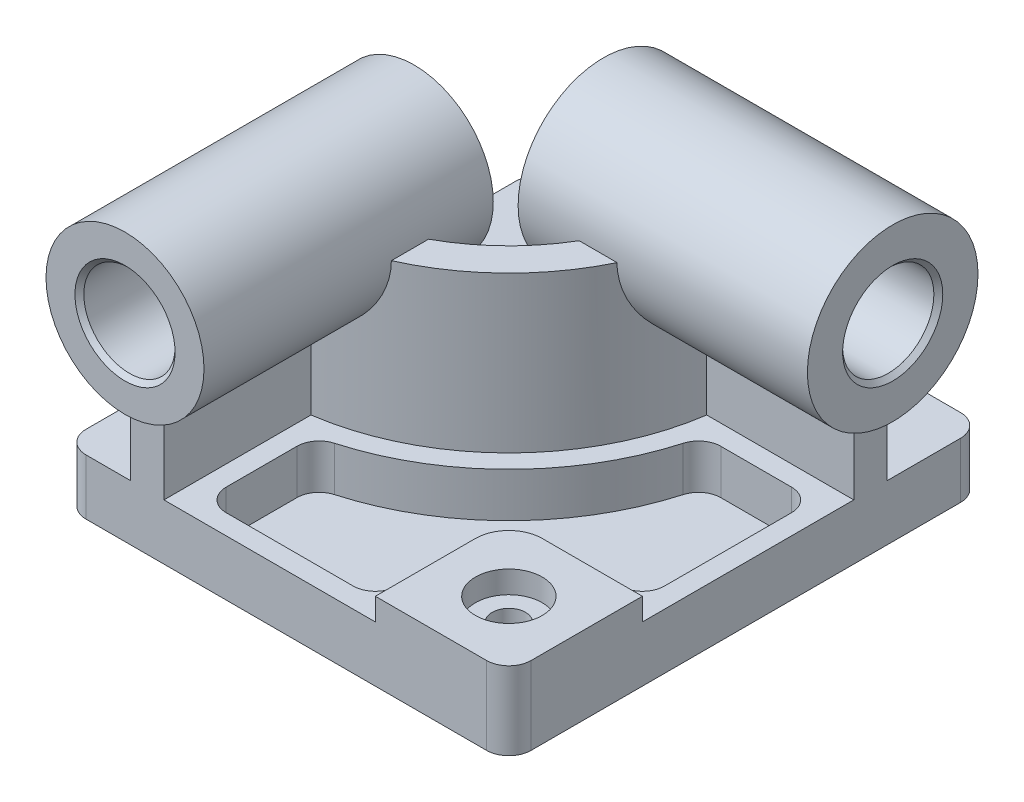
from build123d import *

# Parameters (mm, degrees)
BOSS_EXTRUDE1_DEPTH      = 25
BOSS_EXTRUDE2_DEPTH      = 35
BOSS_EXTRUDE3_DEPTH      = 95
CUT_EXTRUDE1_START       = 25
CUT_EXTRUDE1_DEPTH       = 20
BOSS_EXTRUDE4_DEPTH      = 10
BOSS_EXTRUDE4_DEPTH_BACK = 120
SKETCH3_R                = 38.333333333
BOSS_EXTRUDE5_DEPTH      = 10
BOSS_EXTRUDE5_DEPTH_BACK = 120
SKETCH4_R                = 35.5
SKETCH5_R                = 20.5
CUT_EXTRUDE2_DEPTH       = 130
SKETCH6_R                = 20.5
CUT_EXTRUDE3_DEPTH       = 130
CHAMFER1_SIZE            = 2
SKETCH7_R                = 7.5
CUT_EXTRUDE4_DEPTH       = 35
SKETCH7_3_R              = 15
SKETCH7_3_R_2            = 7.5
CUT_EXTRUDE5_DEPTH       = 10


with BuildPart() as part:
    # Sketch1 → Boss-Extrude1 (new body)
    # profile 1 of 5: a face of its own
    with BuildSketch(Plane(origin=(0, 0, 0), x_dir=(1, 0, 0), z_dir=(0, 1, 0))):
        with BuildLine():
            Line((-90, -106.5), (-70, -106.5))
            Line((-70, -106.5), (-70, -26.5))
            ThreePointArc((-70, -26.5), (-6.360389693, -0.139610307), (20, 63.5))
            Line((20, 63.5), (100, 63.5))
            Line((100, 63.5), (100, 96.5))
            ThreePointArc((100, 96.5), (97.071067812, 103.571067812), (90, 106.5))
            Line((90, 106.5), (-90, 106.5))
            ThreePointArc((-90, 106.5), (-97.071067812, 103.571067812), (-100, 96.5))
            Line((-100, 96.5), (-100, -96.5))
            ThreePointArc((-100, -96.5), (-97.071067812, -103.571067812), (-90, -106.5))
        make_face()
    # profile 2 of 5: a face of its own
    with BuildSketch(Plane(origin=(0, 0, 0), x_dir=(1, 0, 0), z_dir=(0, 1, 0))):
        with BuildLine():
            Line((-70, -26.5), (-70, -106.5))
            Line((-70, -106.5), (-55, -106.5))
            Line((-55, -106.5), (-55, -40.423048454))
            ThreePointArc((-55, -40.423048454), (4.246212025, -10.746212025), (33.923048454, 48.5))
            Line((33.923048454, 48.5), (100, 48.5))
            Line((100, 48.5), (100, 63.5))
            Line((100, 63.5), (20, 63.5))
            ThreePointArc((20, 63.5), (-6.360389693, -0.139610307), (-70, -26.5))
        make_face()
    # profile 3 of 5: a face of its own
    with BuildSketch(Plane(origin=(0, 0, 0), x_dir=(1, 0, 0), z_dir=(0, 1, 0))):
        with BuildLine():
            Line((-55, -40.423048454), (-55, -106.5))
            Line((-55, -106.5), (40, -106.5))
            Line((40, -106.5), (40, -61.5))
            ThreePointArc((40, -61.5), (44.393398282, -50.893398282), (55, -46.5))
            Line((55, -46.5), (100, -46.5))
            Line((100, -46.5), (100, 48.5))
            Line((100, 48.5), (33.923048454, 48.5))
            ThreePointArc((33.923048454, 48.5), (4.246212025, -10.746212025), (-55, -40.423048454))
        make_face()
        with BuildLine():
            ThreePointArc((-36, -97.5), (-43.071067812, -94.571067812), (-46, -87.5))
            Line((-46, -87.5), (-46, -55.747641486))
            ThreePointArc((-46, -55.747641486), (-43.981834214, -49.723496519), (-38.741935484, -46.130896205))
            ThreePointArc((-38.741935484, -46.130896205), (10.610173055, -17.110173055), (39.630896205, 32.241935484))
            ThreePointArc((39.630896205, 32.241935484), (43.223496519, 37.481834214), (49.247641486, 39.5))
            Line((49.247641486, 39.5), (81, 39.5))
            ThreePointArc((81, 39.5), (88.071067812, 36.571067812), (91, 29.5))
            Line((91, 29.5), (91, -27.5))
            ThreePointArc((91, -27.5), (88.071067812, -34.571067812), (81, -37.5))
            Line((81, -37.5), (55, -37.5))
            ThreePointArc((55, -37.5), (38.029437252, -44.529437252), (31, -61.5))
            Line((31, -61.5), (31, -87.5))
            ThreePointArc((31, -87.5), (28.071067812, -94.571067812), (21, -97.5))
            Line((21, -97.5), (-36, -97.5))
        make_face(mode=Mode.SUBTRACT)
    # profile 4 of 5: a face of its own
    with BuildSketch(Plane(origin=(0, 0, 0), x_dir=(1, 0, 0), z_dir=(0, 1, 0))):
        with BuildLine():
            Line((21, -97.5), (-36, -97.5))
            ThreePointArc((-36, -97.5), (-43.071067812, -94.571067812), (-46, -87.5))
            Line((-46, -87.5), (-46, -55.747641486))
            ThreePointArc((-46, -55.747641486), (-43.981834214, -49.723496519), (-38.741935484, -46.130896205))
            ThreePointArc((-38.741935484, -46.130896205), (10.610173055, -17.110173055), (39.630896205, 32.241935484))
            ThreePointArc((39.630896205, 32.241935484), (43.223496519, 37.481834214), (49.247641486, 39.5))
            Line((49.247641486, 39.5), (81, 39.5))
            ThreePointArc((81, 39.5), (88.071067812, 36.571067812), (91, 29.5))
            Line((91, 29.5), (91, -27.5))
            ThreePointArc((91, -27.5), (88.071067812, -34.571067812), (81, -37.5))
            Line((81, -37.5), (55, -37.5))
            ThreePointArc((55, -37.5), (38.029437252, -44.529437252), (31, -61.5))
            Line((31, -61.5), (31, -87.5))
            ThreePointArc((31, -87.5), (28.071067812, -94.571067812), (21, -97.5))
        make_face()
    # profile 5 of 5: a face of its own
    with BuildSketch(Plane(origin=(0, 0, 0), x_dir=(1, 0, 0), z_dir=(0, 1, 0))):
        with BuildLine():
            Line((40, -61.5), (40, -106.5))
            Line((40, -106.5), (90, -106.5))
            ThreePointArc((90, -106.5), (97.071067812, -103.571067812), (100, -96.5))
            Line((100, -96.5), (100, -46.5))
            Line((100, -46.5), (55, -46.5))
            ThreePointArc((55, -46.5), (44.393398282, -50.893398282), (40, -61.5))
        make_face()
    extrude(amount=BOSS_EXTRUDE1_DEPTH)

    # Sketch1<3> → Boss-Extrude2 (add)
    with BuildSketch(Plane(origin=(0, 0, 0), x_dir=(1, 0, 0), z_dir=(0, 1, 0))):
        with BuildLine():
            Line((90, -106.5), (40, -106.5))
            Line((40, -106.5), (40, -61.5))
            ThreePointArc((40, -61.5), (44.393398282, -50.893398282), (55, -46.5))
            Line((55, -46.5), (100, -46.5))
            Line((100, -46.5), (100, -96.5))
            ThreePointArc((100, -96.5), (97.071067812, -103.571067812), (90, -106.5))
        make_face()
    extrude(amount=BOSS_EXTRUDE2_DEPTH)

    # Sketch1<4> → Boss-Extrude3 (add)
    with BuildSketch(Plane(origin=(0, 0, 0), x_dir=(1, 0, 0), z_dir=(0, 1, 0))):
        with BuildLine():
            Line((-70, -106.5), (-70, -26.5))
            ThreePointArc((-70, -26.5), (-6.360389693, -0.139610307), (20, 63.5))
            Line((20, 63.5), (100, 63.5))
            Line((100, 63.5), (100, 48.5))
            Line((100, 48.5), (33.923048454, 48.5))
            ThreePointArc((33.923048454, 48.5), (4.246212025, -10.746212025), (-55, -40.423048454))
            Line((-55, -40.423048454), (-55, -106.5))
            Line((-55, -106.5), (-70, -106.5))
        make_face()
    extrude(amount=BOSS_EXTRUDE3_DEPTH)

    # Sketch1<5> → Cut-Extrude1 (cut)
    with BuildSketch(Plane(origin=(0, 0, 0), x_dir=(1, 0, 0), z_dir=(0, 1, 0)).offset(CUT_EXTRUDE1_START)):
        with BuildLine():
            Line((-46, -87.5), (-46, -55.747641486))
            ThreePointArc((-46, -55.747641486), (-43.981834214, -49.723496519), (-38.741935484, -46.130896205))
            ThreePointArc((-38.741935484, -46.130896205), (10.610173055, -17.110173055), (39.630896205, 32.241935484))
            ThreePointArc((39.630896205, 32.241935484), (43.223496519, 37.481834214), (49.247641486, 39.5))
            Line((49.247641486, 39.5), (81, 39.5))
            ThreePointArc((81, 39.5), (88.071067812, 36.571067812), (91, 29.5))
            Line((91, 29.5), (91, -27.5))
            ThreePointArc((91, -27.5), (88.071067812, -34.571067812), (81, -37.5))
            Line((81, -37.5), (55, -37.5))
            ThreePointArc((55, -37.5), (38.029437252, -44.529437252), (31, -61.5))
            Line((31, -61.5), (31, -87.5))
            ThreePointArc((31, -87.5), (28.071067812, -94.571067812), (21, -97.5))
            Line((21, -97.5), (-36, -97.5))
            ThreePointArc((-36, -97.5), (-43.071067812, -94.571067812), (-46, -87.5))
        make_face()
    extrude(amount=-CUT_EXTRUDE1_DEPTH, mode=Mode.SUBTRACT)

    # Sketch3 → Boss-Extrude4 (add, two sides: drawn at the far end of the back side and taken through both)
    with BuildSketch(Plane(origin=(100, 0, 0), x_dir=(0, 0, -1), z_dir=(1, 0, 0)).offset(-BOSS_EXTRUDE4_DEPTH_BACK)):
        with Locations((56, 95)):
            Circle(SKETCH3_R)
    extrude(amount=BOSS_EXTRUDE4_DEPTH + BOSS_EXTRUDE4_DEPTH_BACK)

    # Sketch4 → Boss-Extrude5 (add, two sides: drawn at the far end of the back side and taken through both)
    with BuildSketch(Plane.XY.offset(106.5).offset(-BOSS_EXTRUDE5_DEPTH_BACK)):
        with Locations((-62.5, 95)):
            Circle(SKETCH4_R)
    extrude(amount=BOSS_EXTRUDE5_DEPTH + BOSS_EXTRUDE5_DEPTH_BACK)

    # Sketch5 → Cut-Extrude2 (cut)
    with BuildSketch(Plane(origin=(110, 0, 0), x_dir=(0, 0, -1), z_dir=(1, 0, 0))):
        with Locations((56, 95)):
            Circle(SKETCH5_R)
    extrude(amount=-CUT_EXTRUDE2_DEPTH, mode=Mode.SUBTRACT)

    # Sketch6 → Cut-Extrude3 (cut)
    with BuildSketch(Plane.XY.offset(116.5)):
        with Locations((-62.5, 95)):
            Circle(SKETCH6_R)
    extrude(amount=-CUT_EXTRUDE3_DEPTH, mode=Mode.SUBTRACT)

    # Chamfer1
    chamfer1_edges = [part.edges().sort_by_distance(p)[0] for p in [
        (110, 95, -35.5),
        (-20, 95, -35.5),
        (-83, 95, 116.5),
        (-83, 95, -13.5),
    ]]
    chamfer(chamfer1_edges, length=CHAMFER1_SIZE)

    # Sketch7 → Cut-Extrude4 (cut)
    with BuildSketch(Plane(origin=(0, 35, 0), x_dir=(1, 0, 0), z_dir=(0, 1, 0))):
        with Locations(Location((70, -76.5, 0), (0, 0, 270))):
            Circle(SKETCH7_R)
    extrude(amount=-CUT_EXTRUDE4_DEPTH, mode=Mode.SUBTRACT)

    # Sketch7<3> → Cut-Extrude5 (cut)
    with BuildSketch(Plane(origin=(0, 35, 0), x_dir=(1, 0, 0), z_dir=(0, 1, 0))):
        with Locations(Location((70, -76.5, 0), (0, 0, 270))):
            Circle(SKETCH7_3_R)
        with Locations(Location((70, -76.5, 0), (0, 0, 270))):
            Circle(SKETCH7_3_R_2, mode=Mode.SUBTRACT)
    extrude(amount=-CUT_EXTRUDE5_DEPTH, mode=Mode.SUBTRACT)


solid = part.part
